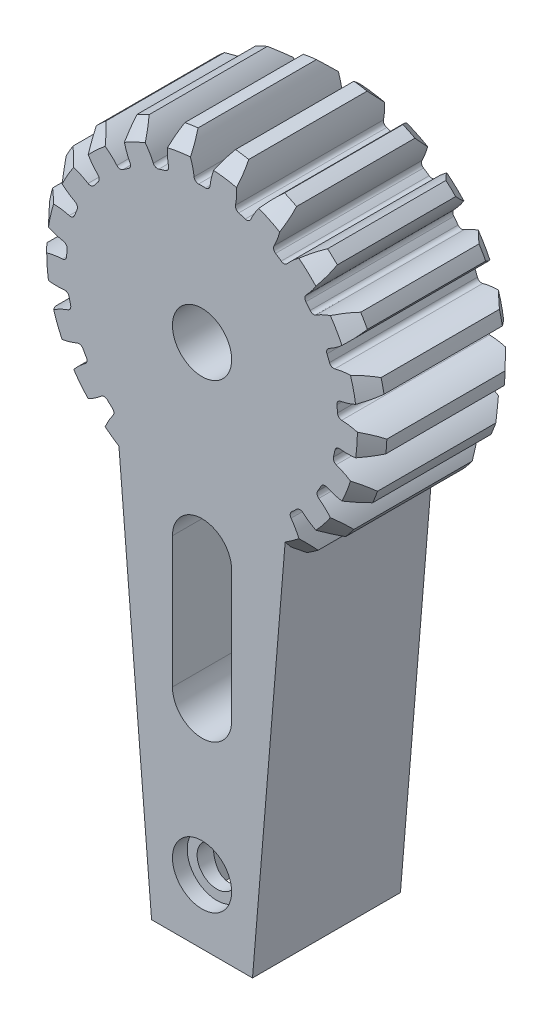
from build123d import *

# Parameters (mm, degrees)
ESQUISSE2_R                        = 17.25
BOSS_EXTRU_1_DEPTH                 = 15
ENL_V_START                        = -15
ENL_V_MAT_EXTRU_2_DEPTH            = 44.637824638
CONG_1_R                           = 0.45
CHANFREIN1_SIZE                    = 1.5
R_P_TITION_CIRCULAIRE1_COUNT       = 21
CONG_1_OF_R_P_TITION_CIRCULAIRE1_R = 0.45
BOSS_EXTRU_2_DEPTH                 = 15
ENL_V_MAT_EXTRU_3_DEPTH            = 6.402822
ESQUISSE1_4_R                      = 1.5
ENL_V_MAT_EXTRU_4_DEPTH            = 58.946080704
ENL_V_START_2                      = 15
ESQUISSE5_R                        = 3
ENL_V_MAT_EXTRU_8_DEPTH            = 6.502822
ENL_V_START_3                      = 6.402822
ENL_V_MAT_EXTRU_9_DEPTH            = 1.48
ESQUISSE7_R                        = 4.8
ENL_V_MAT_EXTRU_10_DEPTH           = 13
ENL_V_MAT_EXTRU_11_DEPTH           = 58.946080704
ENL_V_MAT_EXTRU_11_DEPTH_BACK      = 58.946080704
ESQUISSE11_R                       = 2
ENL_V_START_4                      = 13.5
ESQUISSE11_4_R                     = 3
ESQUISSE11_4_R_2                   = 2
ENL_V_MAT_EXTRU_12_DEPTH           = 1.5
ESQUISSE11_5_R                     = 3
ESQUISSE11_5_R_2                   = 2
ENL_V_MAT_EXTRU_13_DEPTH           = 1.5


with BuildPart() as part:
    # Esquisse2 → Boss.-Extru.1 (new body)
    with BuildSketch(Plane.XY):
        Circle(ESQUISSE2_R)
    extrude(amount=BOSS_EXTRU_1_DEPTH)

    # Esquisse3 → Enlèv. mat.-Extru.2 (cut)
    with BuildSketch(Plane.XY.offset(ENL_V_START)):
        with BuildLine():
            ThreePointArc((1.900359581, 17.145003163), (0, 17.25), (-1.900359581, 17.145003163))
            ThreePointArc((-1.900359581, 17.145003163), (-1.109464114, 15.511447054), (-0.770814256, 13.728377376))
            ThreePointArc((-0.770814256, 13.728377376), (0, 13.75), (0.770814256, 13.728377376))
            ThreePointArc((0.770814256, 13.728377376), (1.109464114, 15.511447054), (1.900359581, 17.145003163))
        make_face()
    enl_v_mat_extru_2 = extrude(amount=ENL_V_MAT_EXTRU_2_DEPTH, mode=Mode.SUBTRACT)

    # Congé1
    cong_1_edges = [part.edges().sort_by_distance(p)[0] for p in [
        (-0.770814256, 13.728377376, 7.5),
        (0.770814256, 13.728377376, 7.5),
    ]]
    fillet(cong_1_edges, radius=CONG_1_R)

    # Chanfrein1
    chanfrein1_edges = [part.edges().sort_by_distance(p)[0] for p in [
        (0, -17.25, 0),
        (0, -17.25, 15),
    ]]
    chamfer(chanfrein1_edges, length=CHANFREIN1_SIZE)

    # Répétition circulaire1: Enlèv. mat.-Extru.2 ×21 about axis
    r_p_tition_circulaire1_axis = Axis((0, 0, 0), (0, 0, 1))
    for i in range(1, R_P_TITION_CIRCULAIRE1_COUNT):
        add(enl_v_mat_extru_2.rotate(r_p_tition_circulaire1_axis, i * 360 / R_P_TITION_CIRCULAIRE1_COUNT), mode=Mode.SUBTRACT)

    # Congé1 of Répétition circulaire1
    cong_1_of_r_p_tition_circulaire1_edges = [part.edges().sort_by_distance(p)[0] for p in [
        (-4.78307941, 12.891262598, 7.5),
        (-3.309941126, 13.345665579, 7.5),
        (-8.370346967, 10.908702565, 7.5),
        (-7.096593714, 11.777132828, 7.5),
        (-11.213872464, 7.956856437, 7.5),
        (-10.252682808, 9.162150143, 7.5),
        (-13.060996181, 4.298008697, 7.5),
        (-12.497776041, 5.73307021, 7.5),
        (-13.74759307, 0.257264023, 7.5),
        (-13.632387027, 1.79458183, 7.5),
        (-13.212655985, -3.806339689, 7.5),
        (-13.555700601, -2.303363022, 7.5),
        (-11.503716432, -7.531733416, 7.5),
        (-12.274530689, -6.19664396, 7.5),
        (-8.772621192, -10.587899576, 7.5),
        (-9.902714859, -9.53932589, 7.5),
        (-5.26204006, -12.703284394, 7.5),
        (-6.650999356, -12.034396851, 7.5),
        (-1.283903577, -13.689926647, 7.5),
        (-2.808313373, -13.46015884, 7.5),
        (2.808313373, -13.46015884, 7.5),
        (1.283903577, -13.689926647, 7.5),
        (6.650999356, -12.034396851, 7.5),
        (5.26204006, -12.703284394, 7.5),
        (9.902714859, -9.53932589, 7.5),
        (8.772621192, -10.587899576, 7.5),
        (12.274530689, -6.19664396, 7.5),
        (11.503716432, -7.531733416, 7.5),
        (13.555700601, -2.303363022, 7.5),
        (13.212655985, -3.806339689, 7.5),
        (13.632387027, 1.79458183, 7.5),
        (13.74759307, 0.257264023, 7.5),
        (12.497776041, 5.73307021, 7.5),
        (13.060996181, 4.298008697, 7.5),
        (10.252682808, 9.162150143, 7.5),
        (11.213872464, 7.956856437, 7.5),
        (7.096593714, 11.777132828, 7.5),
        (8.370346967, 10.908702565, 7.5),
        (3.309941126, 13.345665579, 7.5),
        (4.78307941, 12.891262598, 7.5),
    ]]
    fillet(cong_1_of_r_p_tition_circulaire1_edges, radius=CONG_1_OF_R_P_TITION_CIRCULAIRE1_R)

    # Esquisse1 → Boss.-Extru.2 (add)
    with BuildSketch(Plane.XY):
        with BuildLine():
            Line((9.467509431, -0.785025591), (6.976373904, -30.828439919))
            Line((6.976373904, -30.828439919), (5.117226196, -53.25))
            Line((5.117226196, -53.25), (-5.117226196, -53.25))
            Line((-5.117226196, -53.25), (-6.976373904, -30.828439919))
            Line((-6.976373904, -30.828439919), (-9.467509431, -0.785025591))
            ThreePointArc((-9.467509431, -0.785025591), (-9.429876643, 1.152139965), (-9, 3.041381265))
            Line((-9, 3.041381265), (-9, 10.75))
            Line((-9, 10.75), (9, 10.75))
            Line((9, 10.75), (9, 3.041381265))
            ThreePointArc((9, 3.041381265), (9.429876643, 1.152139965), (9.467509431, -0.785025591))
        make_face()
    extrude(amount=BOSS_EXTRU_2_DEPTH)

    # Esquisse1<3> → Enlèv. mat.-Extru.3 (cut)
    with BuildSketch(Plane.XY):
        with BuildLine():
            Line((7.972639521, -0.661074182), (5.481503994, -30.70448851))
            ThreePointArc((5.481503994, -30.70448851), (3.725135821, -34.296690609), (0, -35.750000001))
            ThreePointArc((0, -35.750000001), (-3.725135821, -34.296690609), (-5.481503994, -30.70448851))
            Line((-5.481503994, -30.70448851), (-7.972639521, -0.661074182))
            ThreePointArc((-7.972639521, -0.661074182), (-7.925753877, 1.087393894), (-7.5, 2.783882181))
            Line((-7.5, 2.783882181), (-7.5, 9.25))
            Line((-7.5, 9.25), (7.5, 9.25))
            Line((7.5, 9.25), (7.5, 2.783882181))
            ThreePointArc((7.5, 2.783882181), (7.925753877, 1.087393894), (7.972639521, -0.661074182))
        make_face()
    extrude(amount=ENL_V_MAT_EXTRU_3_DEPTH, mode=Mode.SUBTRACT)

    # Esquisse1<4> → Enlèv. mat.-Extru.4 (cut, through all)
    with BuildSketch(Plane.XY):
        with Locations(Location((0, -25.110000007, 0), (0, 0, 180))):
            Circle(ESQUISSE1_4_R)
        with Locations(Location((0, -19.970000001, 0), (0, 0, 180))):
            Circle(ESQUISSE1_4_R)
        with Locations(Location((-0.000314323, -30.25000001, 0), (0, 0, 180))):
            Circle(ESQUISSE1_4_R)
        with Locations(Location((0, 0, 0), (0, 0, 180))):
            Circle(ESQUISSE1_4_R)
    extrude(amount=ENL_V_MAT_EXTRU_4_DEPTH, mode=Mode.SUBTRACT)

    # Esquisse5 → Enlèv. mat.-Extru.8 (cut)
    with BuildSketch(Plane.XY.offset(ENL_V_START_2)):
        Circle(ESQUISSE5_R)
        with BuildLine():
            Line((-3, -31.750000013), (-3, -18.470000001))
            ThreePointArc((-3, -18.470000001), (0, -15.470000001), (3, -18.470000001))
            Line((3, -18.470000001), (3, -31.750000013))
            ThreePointArc((3, -31.750000013), (0, -34.750000013), (-3, -31.750000013))
        make_face()
    extrude(amount=-ENL_V_MAT_EXTRU_8_DEPTH, mode=Mode.SUBTRACT)

    # Esquisse6 → Enlèv. mat.-Extru.9 (cut)
    with BuildSketch(Plane.XY.offset(ENL_V_START_3)):
        with BuildLine():
            Line((-7.5, 2.783882181), (-7.5, 9.25))
            Line((-7.5, 9.25), (7.5, 9.25))
            Line((7.5, 9.25), (7.5, 2.783882181))
            ThreePointArc((7.5, 2.783882181), (0, -8), (-7.5, 2.783882181))
        make_face()
    extrude(amount=ENL_V_MAT_EXTRU_9_DEPTH, mode=Mode.SUBTRACT)

    # Esquisse7 → Enlèv. mat.-Extru.10 (cut)
    with BuildSketch(Plane(origin=(0, -53.25, 0), x_dir=(-1, 0, 0), z_dir=(0, -1, 0))):
        with Locations(Location((0, -7.5, 0), (0, 0, 90))):
            Circle(ESQUISSE7_R)
    extrude(amount=-ENL_V_MAT_EXTRU_10_DEPTH, mode=Mode.SUBTRACT)

    # Esquisse11 → Enlèv. mat.-Extru.11 (cut, two sides: drawn at the far end of the back side and taken through both)
    with BuildSketch(Plane.XY.offset(-ENL_V_MAT_EXTRU_11_DEPTH_BACK)):
        with Locations(Location((0, -46.75, 0), (0, 0, 180))):
            Circle(ESQUISSE11_R)
    extrude(amount=ENL_V_MAT_EXTRU_11_DEPTH + ENL_V_MAT_EXTRU_11_DEPTH_BACK, mode=Mode.SUBTRACT)

    # Esquisse11<4> → Enlèv. mat.-Extru.12 (cut)
    with BuildSketch(Plane.XY.offset(ENL_V_START_4)):
        with Locations((0, -46.75)):
            Circle(ESQUISSE11_4_R)
        with Locations(Location((0, -46.75, 0), (0, 0, 180))):
            Circle(ESQUISSE11_4_R_2, mode=Mode.SUBTRACT)
    extrude(amount=ENL_V_MAT_EXTRU_12_DEPTH, mode=Mode.SUBTRACT)

    # Esquisse11<5> → Enlèv. mat.-Extru.13 (cut)
    with BuildSketch(Plane.XY):
        with Locations((0, -46.75)):
            Circle(ESQUISSE11_5_R)
        with Locations(Location((0, -46.75, 0), (0, 0, 180))):
            Circle(ESQUISSE11_5_R_2, mode=Mode.SUBTRACT)
    extrude(amount=ENL_V_MAT_EXTRU_13_DEPTH, mode=Mode.SUBTRACT)


solid = part.part
